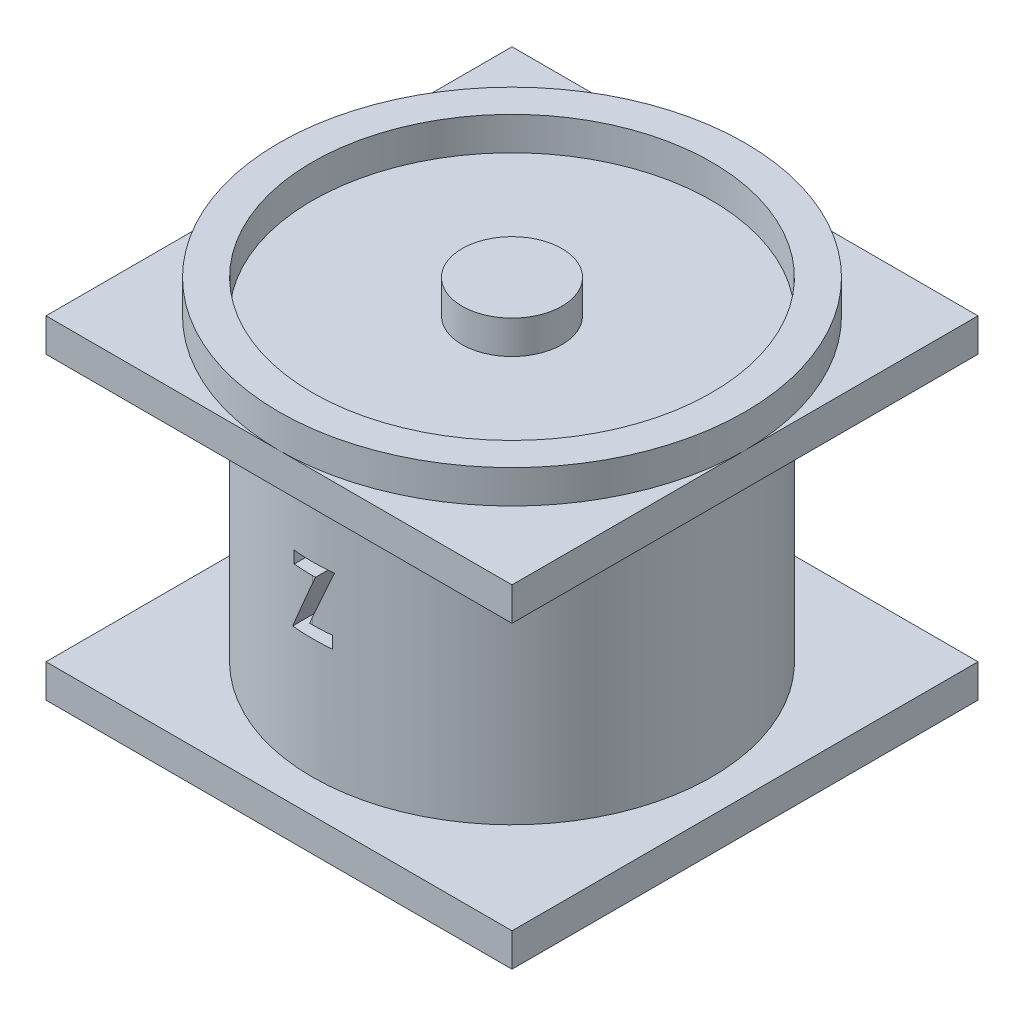
from build123d import *

# Parameters (mm, degrees)
SKETCH1_W           = 140
SKETCH1_H           = 140
BOSS_EXTRUDE1_DEPTH = 10
SKETCH2_R           = 60
BOSS_EXTRUDE2_DEPTH = 80
SKETCH3_W           = 140
SKETCH3_H           = 140
BOSS_EXTRUDE3_DEPTH = 10
SKETCH4_R           = 70
SKETCH4_R_2         = 60
BOSS_EXTRUDE4_DEPTH = 10
SKETCH5_R           = 15
BOSS_EXTRUDE5_DEPTH = 10
CUT_EXTRUDE1_DEPTH  = 10


with BuildPart() as part:
    # Sketch1 → Boss-Extrude1 (new body)
    with BuildSketch(Plane(origin=(0, 0, 0), x_dir=(1, 0, 0), z_dir=(0, 1, 0))):
        Rectangle(SKETCH1_W, SKETCH1_H)
    extrude(amount=BOSS_EXTRUDE1_DEPTH)

    # Sketch2 → Boss-Extrude2 (add)
    with BuildSketch(Plane(origin=(0, 10, 0), x_dir=(1, 0, 0), z_dir=(0, 1, 0))):
        with Locations(Location((0, 0, 0), (0, 0, 270))):
            Circle(SKETCH2_R)
    extrude(amount=BOSS_EXTRUDE2_DEPTH)

    # Sketch3 → Boss-Extrude3 (add)
    with BuildSketch(Plane(origin=(0, 90, 0), x_dir=(1, 0, 0), z_dir=(0, 1, 0))):
        Rectangle(SKETCH3_W, SKETCH3_H)
    extrude(amount=BOSS_EXTRUDE3_DEPTH)

    # Sketch4 → Boss-Extrude4 (add)
    with BuildSketch(Plane(origin=(0, 100, 0), x_dir=(1, 0, 0), z_dir=(0, 1, 0))):
        with Locations(Location((0, 0, 0), (0, 0, 270))):
            Circle(SKETCH4_R)
        with Locations(Location((0, 0, 0), (0, 0, 270))):
            Circle(SKETCH4_R_2, mode=Mode.SUBTRACT)
    extrude(amount=BOSS_EXTRUDE4_DEPTH)

    # Sketch5 → Boss-Extrude5 (add)
    with BuildSketch(Plane(origin=(0, 100, 0), x_dir=(1, 0, 0), z_dir=(0, 1, 0))):
        with Locations(Location((0, 0, 0), (0, 0, 270))):
            Circle(SKETCH5_R)
    extrude(amount=BOSS_EXTRUDE5_DEPTH)

    # Sketch6 → Cut-Extrude1 (cut)
    with BuildSketch(Plane.XY.offset(60)):
        Polygon((-5.699347884, 66.036762617), (6.351934167, 66.036762617), (-0.811527371, 49.626506206), (5.839113654, 49.626506206), (5.839113654, 46.036762617), (-6.212168397, 46.036762617), (0.955299552, 62.447019027), (-5.699347884, 62.447019027), align=None)
    extrude(amount=-CUT_EXTRUDE1_DEPTH, mode=Mode.SUBTRACT)


solid = part.part
